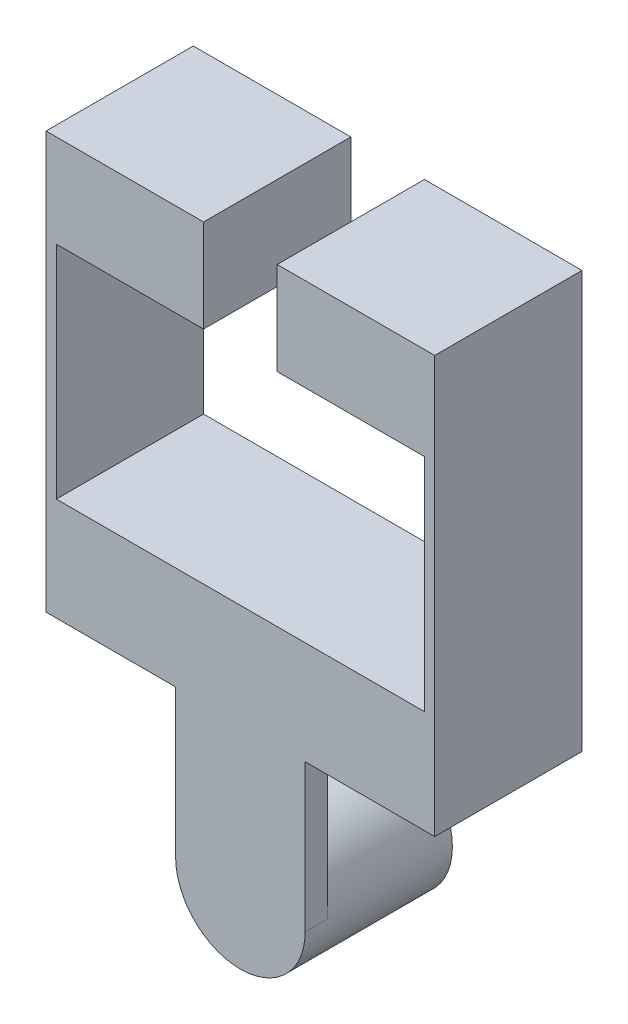
from build123d import *

# Parameters (mm, degrees)
BOSS_EXTRUDE2_DEPTH = 25.4
SKETCH2_W           = 22.352
SKETCH2_H           = 25.4
BOSS_EXTRUDE3_DEPTH = 3.81
SKETCH5_R           = 11.176
BOSS_EXTRUDE6_DEPTH = 25.4


with BuildPart() as part:
    # Sketch1 → Boss-Extrude2 (new body)
    with BuildSketch(Plane.XY):
        Polygon((-12.043317073, 53.947940362), (15.134682927, 53.947940362), (15.134682927, -17.934059638), (-51.921317073, -17.934059638), (-51.921317073, 53.947940362), (-24.743317073, 53.947940362), (-24.743317073, 37.945940362), (-50.143317073, 37.945940362), (-50.143317073, -0.154059638), (13.356682927, -0.154059638), (13.356682927, 37.945940362), (-12.043317073, 37.945940362), align=None)
    extrude(amount=BOSS_EXTRUDE2_DEPTH)

    # Sketch2 → Boss-Extrude3 (add)
    with BuildSketch(Plane.XY.offset(25.4)):
        with Locations((-18.393317073, -30.634059638)):
            Rectangle(SKETCH2_W, SKETCH2_H)
    extrude(amount=-BOSS_EXTRUDE3_DEPTH)

    # Sketch5 → Boss-Extrude6 (add)
    with BuildSketch(Plane.XY.offset(25.4)):
        with Locations((-18.393317073, -43.334059638)):
            Circle(SKETCH5_R)
    extrude(amount=-BOSS_EXTRUDE6_DEPTH)


solid = part.part
